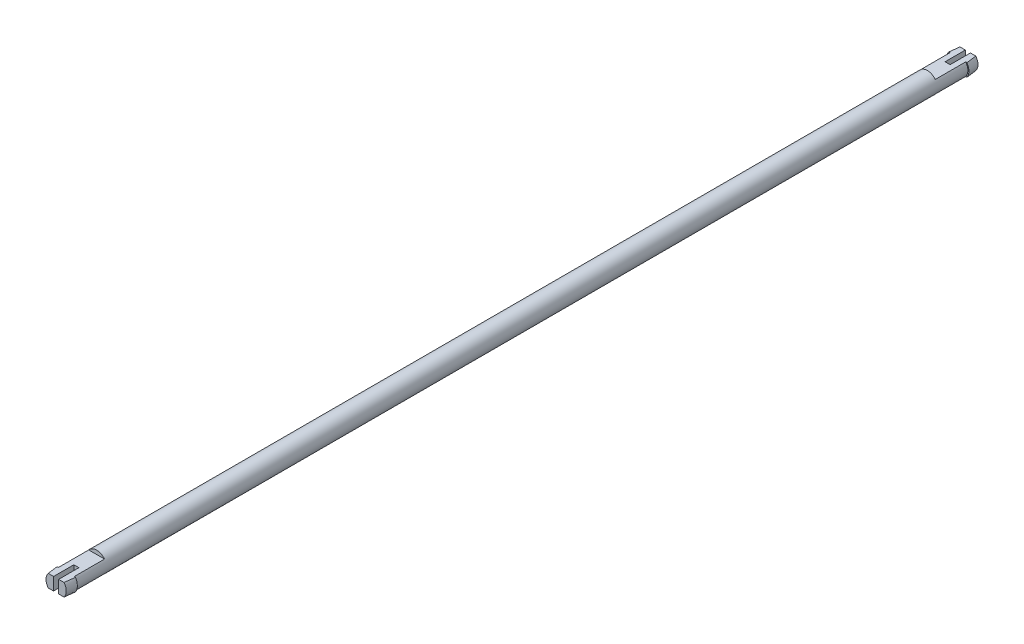
from build123d import *

# Parameters (mm, degrees)
SKETCH_1_R          = 2
EXTRUDE_1_DEPTH     = 180
SKETCH_3_W          = 4.2
SKETCH_3_H          = 1
CUT_EXTRUDE_1_DEPTH = 8
CUT_EXTRUDE_2_REACH = 182.043
SKETCH_4_W          = 1
SKETCH_4_H          = 4
SKETCH_6_W          = 4.2
SKETCH_6_H          = 1
CUT_EXTRUDE_3_DEPTH = 8
SKETCH_7_W          = 1
SKETCH_7_H          = 4
CUT_EXTRUDE_4_DEPTH = 181.042779639


with BuildPart() as part:
    # 草图1 → 凸台-拉伸1 (new body)
    with BuildSketch(Plane.XY):
        Circle(SKETCH_1_R)
    extrude(amount=-EXTRUDE_1_DEPTH)

    # 草图2 → 旋转1 (revolve)
    with BuildSketch(Plane(origin=(0, 0, 0), x_dir=(1, 0, 0), z_dir=(0, 1, 0))):
        Polygon((0, 0), (0, 2), (2.2, 2), (2, 0), align=None)
    revolve(axis=Axis((0, 0, 0), (0, 0, -1)))

    # 草图3 → 切除-拉伸1 (cut)
    with BuildSketch(Plane.XY):
        with Locations((0, 1.75)):
            Rectangle(SKETCH_3_W, SKETCH_3_H)
        with Locations((0, -1.75)):
            Rectangle(SKETCH_3_W, SKETCH_3_H)
    extrude(amount=-CUT_EXTRUDE_1_DEPTH, mode=Mode.SUBTRACT)

    # 草图4 → 切除-拉伸2 (cut, up to next)
    with BuildSketch(Plane.XZ.offset(1.25), mode=Mode.PRIVATE) as cut_extrude_2_sk1:
        with Locations((0, -2)):
            Rectangle(SKETCH_4_W, SKETCH_4_H)
    cut_extrude_2_tool1 = extrude(cut_extrude_2_sk1.sketch, amount=-CUT_EXTRUDE_2_REACH, mode=Mode.PRIVATE) & part.part
    add(cut_extrude_2_tool1.solids().sort_by_distance((0, -1.25, -2))[0], mode=Mode.SUBTRACT)

    # 草图5 → 旋转2 (revolve)
    with BuildSketch(Plane(origin=(0, 0, 0), x_dir=(1, 0, 0), z_dir=(0, 1, 0))):
        Polygon((0, 180), (0, 178), (2.2, 178), (2, 180), align=None)
    revolve(axis=Axis((0, 0, -58.137689197), (0, 0, -1)))

    # 草图6 → 切除-拉伸3 (cut)
    with BuildSketch(Plane(origin=(0, 0, -180), x_dir=(-1, 0, 0), z_dir=(0, 0, -1))):
        with Locations((0, 1.75)):
            Rectangle(SKETCH_6_W, SKETCH_6_H)
        with Locations((0, -1.75)):
            Rectangle(SKETCH_6_W, SKETCH_6_H)
    extrude(amount=-CUT_EXTRUDE_3_DEPTH, mode=Mode.SUBTRACT)

    # 草图7 → 切除-拉伸4 (cut, through all)
    with BuildSketch(Plane(origin=(0, 1.25, 0), x_dir=(1, 0, 0), z_dir=(0, 1, 0))):
        with Locations((0, 178)):
            Rectangle(SKETCH_7_W, SKETCH_7_H)
    extrude(amount=-CUT_EXTRUDE_4_DEPTH, mode=Mode.SUBTRACT)


solid = part.part
